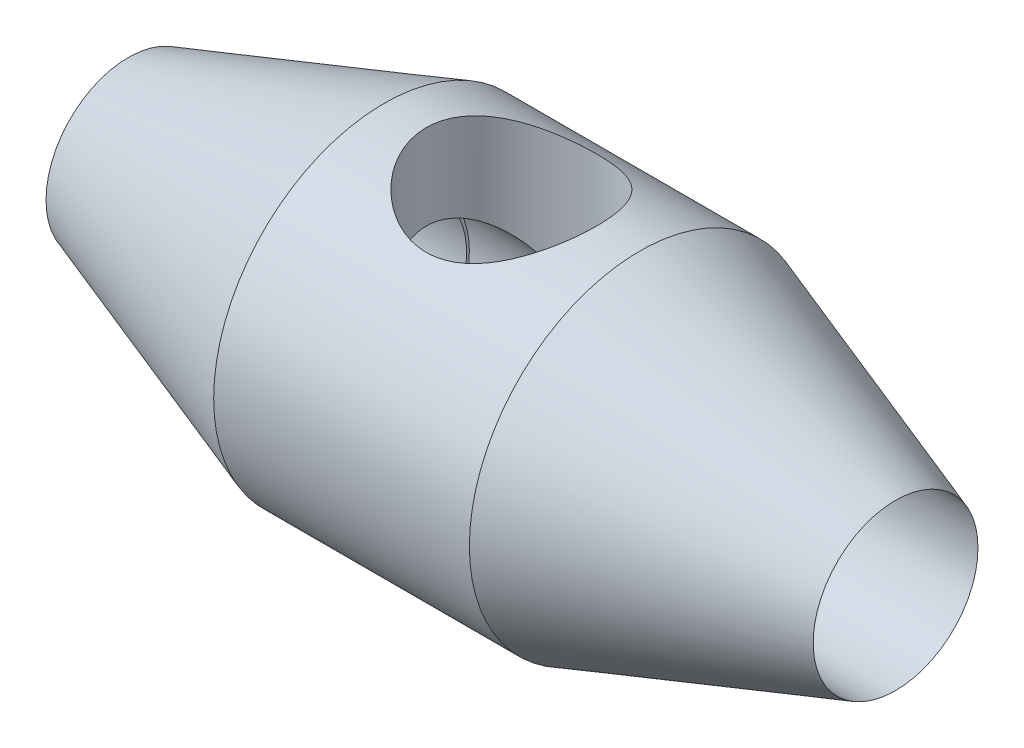
from build123d import *

# Parameters (mm, degrees)
SKETCH1_R           = 50.8
SKETCH1_R_2         = 25.4
BOSS_EXTRUDE1_DEPTH = 76.2
SKETCH2_R           = 50.8
BOSS_EXTRUDE2_DEPTH = 76.2
BOSS_EXTRUDE2_TAPER = 19
SKETCH3_R           = 50.8
BOSS_EXTRUDE3_DEPTH = 76.2
BOSS_EXTRUDE3_TAPER = 19
SKETCH4_R           = 24.562235867
CUT_EXTRUDE1_DEPTH  = 270.002
SKETCH5_R           = 25.4
CUT_EXTRUDE2_DEPTH  = 295.402


with BuildPart() as part:
    # Sketch1 → Boss-Extrude1 (new body)
    with BuildSketch(Plane(origin=(0, 0, 0), x_dir=(0, 0, -1), z_dir=(1, 0, 0))):
        with Locations(Location((0, 0, 0), (0, 0, 180))):
            Circle(SKETCH1_R)
        with Locations(Location((0, 0, 0), (0, 0, 180))):
            Circle(SKETCH1_R_2, mode=Mode.SUBTRACT)
    extrude(amount=BOSS_EXTRUDE1_DEPTH)

    # Sketch2 → Boss-Extrude2 (add)
    with BuildSketch(Plane.ZY):
        Circle(SKETCH2_R)
    extrude(amount=BOSS_EXTRUDE2_DEPTH, taper=BOSS_EXTRUDE2_TAPER)

    # Sketch3 → Boss-Extrude3 (add)
    with BuildSketch(Plane(origin=(76.2, 0, 0), x_dir=(0, 0, -1), z_dir=(1, 0, 0))):
        with Locations(Location((0, 0, 0), (0, 0, 180))):
            Circle(SKETCH3_R)
    extrude(amount=BOSS_EXTRUDE3_DEPTH, taper=BOSS_EXTRUDE3_TAPER)

    # Sketch4 → Cut-Extrude1 (cut)
    with BuildSketch(Plane.ZY.offset(76.2)):
        with Locations(Location((0, 0, 0), (0, 0, 180))):
            Circle(SKETCH4_R)
    extrude(amount=-CUT_EXTRUDE1_DEPTH, mode=Mode.SUBTRACT)

    # Sketch5 → Cut-Extrude2 (cut)
    with BuildSketch(Plane(origin=(0, 254, 0), x_dir=(1, 0, 0), z_dir=(0, 1, 0))):
        with Locations(Location((37.928629542, 0, 0), (0, 0, 270))):
            Circle(SKETCH5_R)
    extrude(amount=-CUT_EXTRUDE2_DEPTH, mode=Mode.SUBTRACT)


solid = part.part
